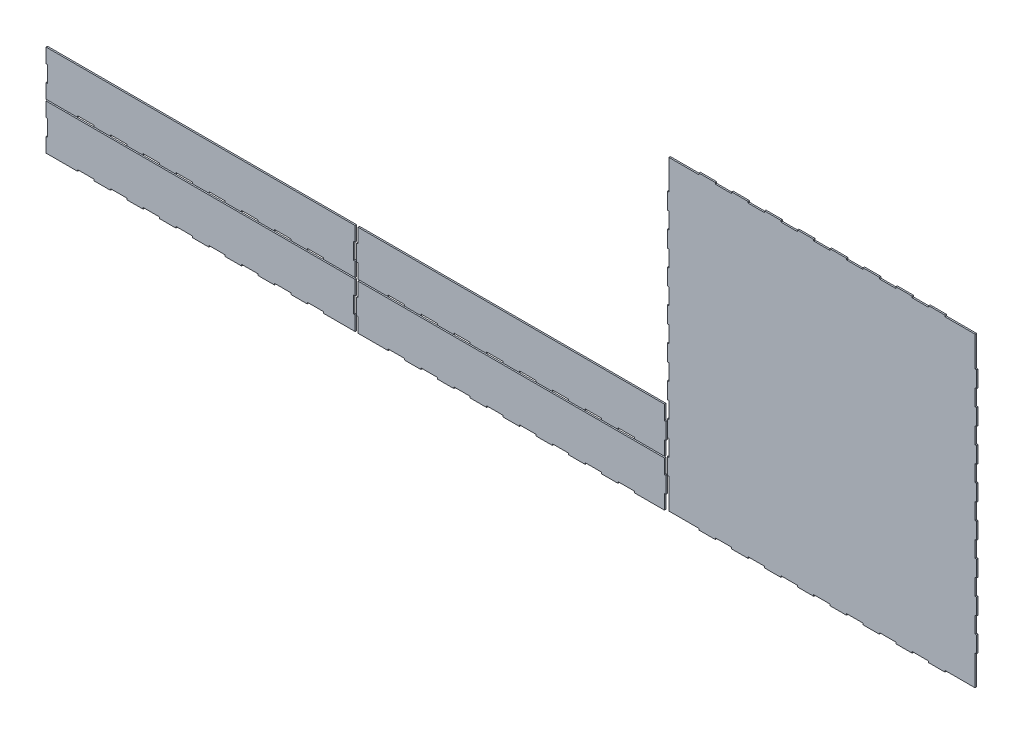
from build123d import *

# Parameters (mm, degrees)
BOSS_EXTRUDE1_DEPTH   = 3
BOSS_EXTRUDE1_2_DEPTH = 3
BOSS_EXTRUDE1_3_DEPTH = 3
BOSS_EXTRUDE1_4_DEPTH = 3
BOSS_EXTRUDE1_5_DEPTH = 3


with BuildPart() as part:
    # Model → Boss-Extrude1 (new body)
    with BuildSketch(Plane.XY):
        Polygon((0, 96), (0, 66.375), (3, 66.375), (3, 32.625), (0, 32.625), (0, 3), (64.875, 3), (64.875, 6), (98.625, 6), (98.625, 3), (132.375, 3), (132.375, 6), (166.125, 6), (166.125, 3), (199.875, 3), (199.875, 6), (233.625, 6), (233.625, 3), (267.375, 3), (267.375, 6), (301.125, 6), (301.125, 3), (334.875, 3), (334.875, 6), (368.625, 6), (368.625, 3), (402.375, 3), (402.375, 6), (436.125, 6), (436.125, 3), (469.875, 3), (469.875, 6), (503.625, 6), (503.625, 3), (537.375, 3), (537.375, 6), (571.125, 6), (571.125, 3), (604.875, 3), (636, 3), (636, 32.625), (633, 32.625), (633, 66.375), (636, 66.375), (636, 96), align=None)
    extrude(amount=BOSS_EXTRUDE1_DEPTH)


with BuildPart() as body_2:
    # Model → Boss-Extrude1 2 (new body)
    with BuildSketch(Plane.XY):
        Polygon((642, 96), (642, 66.375), (639, 66.375), (639, 32.625), (642, 32.625), (642, 3), (703.875, 3), (703.875, 6), (737.625, 6), (737.625, 3), (771.375, 3), (771.375, 6), (805.125, 6), (805.125, 3), (838.875, 3), (838.875, 6), (872.625, 6), (872.625, 3), (906.375, 3), (906.375, 6), (940.125, 6), (940.125, 3), (973.875, 3), (973.875, 6), (1007.625, 6), (1007.625, 3), (1041.375, 3), (1041.375, 6), (1075.125, 6), (1075.125, 3), (1108.875, 3), (1108.875, 6), (1142.625, 6), (1142.625, 3), (1176.375, 3), (1176.375, 6), (1210.125, 6), (1210.125, 3), (1243.875, 3), (1272, 3), (1272, 32.625), (1275, 32.625), (1275, 66.375), (1272, 66.375), (1272, 96), align=None)
    extrude(amount=BOSS_EXTRUDE1_2_DEPTH)


with BuildPart() as body_3:
    # Model → Boss-Extrude1 3 (new body)
    with BuildSketch(Plane.XY):
        Polygon((0, 192), (0, 162.375), (3, 162.375), (3, 128.625), (0, 128.625), (0, 99), (64.875, 99), (64.875, 102), (98.625, 102), (98.625, 99), (132.375, 99), (132.375, 102), (166.125, 102), (166.125, 99), (199.875, 99), (199.875, 102), (233.625, 102), (233.625, 99), (267.375, 99), (267.375, 102), (301.125, 102), (301.125, 99), (334.875, 99), (334.875, 102), (368.625, 102), (368.625, 99), (402.375, 99), (402.375, 102), (436.125, 102), (436.125, 99), (469.875, 99), (469.875, 102), (503.625, 102), (503.625, 99), (537.375, 99), (537.375, 102), (571.125, 102), (571.125, 99), (604.875, 99), (636, 99), (636, 128.625), (633, 128.625), (633, 162.375), (636, 162.375), (636, 192), align=None)
    extrude(amount=BOSS_EXTRUDE1_3_DEPTH)


with BuildPart() as body_4:
    # Model → Boss-Extrude1 4 (new body)
    with BuildSketch(Plane.XY):
        Polygon((642, 192), (642, 162.375), (639, 162.375), (639, 128.625), (642, 128.625), (642, 99), (703.875, 99), (703.875, 102), (737.625, 102), (737.625, 99), (771.375, 99), (771.375, 102), (805.125, 102), (805.125, 99), (838.875, 99), (838.875, 102), (872.625, 102), (872.625, 99), (906.375, 99), (906.375, 102), (940.125, 102), (940.125, 99), (973.875, 99), (973.875, 102), (1007.625, 102), (1007.625, 99), (1041.375, 99), (1041.375, 102), (1075.125, 102), (1075.125, 99), (1108.875, 99), (1108.875, 102), (1142.625, 102), (1142.625, 99), (1176.375, 99), (1176.375, 102), (1210.125, 102), (1210.125, 99), (1243.875, 99), (1272, 99), (1272, 128.625), (1275, 128.625), (1275, 162.375), (1272, 162.375), (1272, 192), align=None)
    extrude(amount=BOSS_EXTRUDE1_4_DEPTH)


with BuildPart() as body_5:
    # Model → Boss-Extrude1 5 (new body)
    with BuildSketch(Plane.XY):
        Polygon((1281, 636), (1281, 574.125), (1278, 574.125), (1278, 540.375), (1281, 540.375), (1281, 506.625), (1278, 506.625), (1278, 472.875), (1281, 472.875), (1281, 439.125), (1278, 439.125), (1278, 405.375), (1281, 405.375), (1281, 371.625), (1278, 371.625), (1278, 337.875), (1281, 337.875), (1281, 304.125), (1278, 304.125), (1278, 270.375), (1281, 270.375), (1281, 236.625), (1278, 236.625), (1278, 202.875), (1281, 202.875), (1281, 169.125), (1278, 169.125), (1278, 135.375), (1281, 135.375), (1281, 101.625), (1278, 101.625), (1278, 67.875), (1281, 67.875), (1281, 34.125), (1281, 6), (1342.875, 6), (1342.875, 3), (1376.625, 3), (1376.625, 6), (1410.375, 6), (1410.375, 3), (1444.125, 3), (1444.125, 6), (1477.875, 6), (1477.875, 3), (1511.625, 3), (1511.625, 6), (1545.375, 6), (1545.375, 3), (1579.125, 3), (1579.125, 6), (1612.875, 6), (1612.875, 3), (1646.625, 3), (1646.625, 6), (1680.375, 6), (1680.375, 3), (1714.125, 3), (1714.125, 6), (1747.875, 6), (1747.875, 3), (1781.625, 3), (1781.625, 6), (1815.375, 6), (1815.375, 3), (1849.125, 3), (1849.125, 6), (1882.875, 6), (1911, 6), (1911, 67.875), (1914, 67.875), (1914, 101.625), (1911, 101.625), (1911, 135.375), (1914, 135.375), (1914, 169.125), (1911, 169.125), (1911, 202.875), (1914, 202.875), (1914, 236.625), (1911, 236.625), (1911, 270.375), (1914, 270.375), (1914, 304.125), (1911, 304.125), (1911, 337.875), (1914, 337.875), (1914, 371.625), (1911, 371.625), (1911, 405.375), (1914, 405.375), (1914, 439.125), (1911, 439.125), (1911, 472.875), (1914, 472.875), (1914, 506.625), (1911, 506.625), (1911, 540.375), (1914, 540.375), (1914, 574.125), (1911, 574.125), (1911, 607.875), (1911, 636), (1849.125, 636), (1849.125, 639), (1815.375, 639), (1815.375, 636), (1781.625, 636), (1781.625, 639), (1747.875, 639), (1747.875, 636), (1714.125, 636), (1714.125, 639), (1680.375, 639), (1680.375, 636), (1646.625, 636), (1646.625, 639), (1612.875, 639), (1612.875, 636), (1579.125, 636), (1579.125, 639), (1545.375, 639), (1545.375, 636), (1511.625, 636), (1511.625, 639), (1477.875, 639), (1477.875, 636), (1444.125, 636), (1444.125, 639), (1410.375, 639), (1410.375, 636), (1376.625, 636), (1376.625, 639), (1342.875, 639), (1342.875, 636), (1309.125, 636), align=None)
    extrude(amount=BOSS_EXTRUDE1_5_DEPTH)


solid = Compound([part.part, body_2.part, body_3.part, body_4.part, body_5.part])
